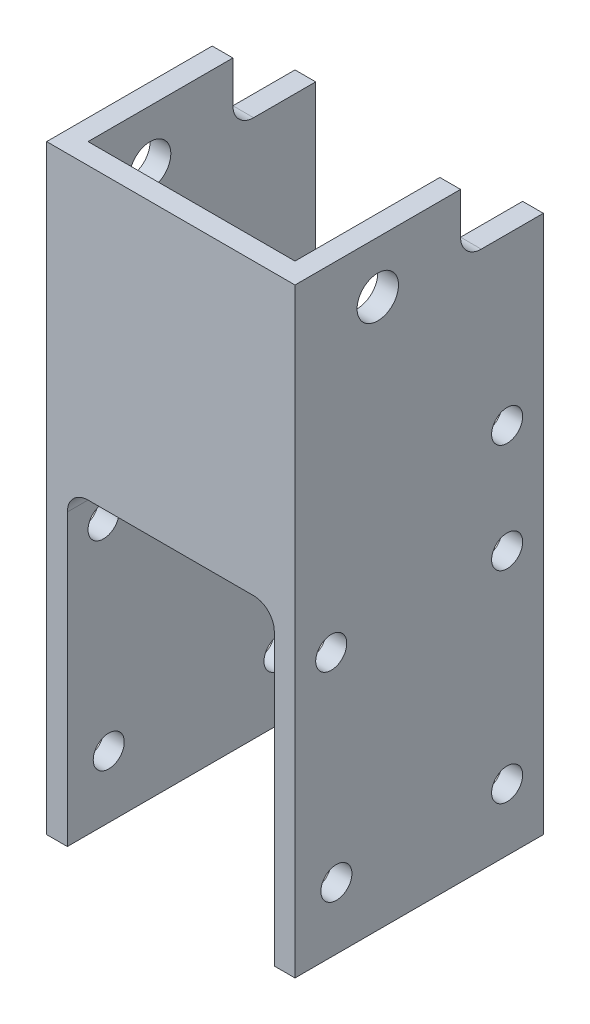
from build123d import *

# Parameters (mm, degrees)
BOSS_EXTRUDE1_DEPTH                 = 184.15
SKETCH2_W                           = 63.5
SKETCH2_H                           = 95.25
CUT_EXTRUDE1_DEPTH                  = 201.603726286
F_3_8_0_375_CLEARANCE_DOWEL_HOLE1_D = 9.525
SKETCH6_W                           = 25.4
SKETCH6_H                           = 19.05
CUT_EXTRUDE2_DEPTH                  = 214.363779728
F_1_2_0_5_DIAMETER_HOLE1_D          = 12.7
FILLET1_R                           = 6.35
F_3_8_0_375_CLAMP_ADJUST_HOLE_D     = 9.525
F_3_8_0_375_CLAMP_ADJUST_HOLE_DEPTH = 82.55
F_3_8_0_375_CLAMP_ADJUST_HOLE_TIP   = 2.861598698


with BuildPart() as part:
    # Sketch1 → Boss-Extrude1 (new body)
    with BuildSketch(Plane(origin=(0, 0, 0), x_dir=(1, 0, 0), z_dir=(0, 1, 0))):
        Polygon((-38.1, 76.2), (-38.1, 0), (0, 0), (38.1, 0), (38.1, 76.2), (31.75, 76.2), (31.75, 6.35), (-31.75, 6.35), (-31.75, 76.2), align=None)
    extrude(amount=BOSS_EXTRUDE1_DEPTH)

    # Sketch2 → Cut-Extrude1 (cut, through all)
    with BuildSketch(Plane(origin=(0, 0, -6.35), x_dir=(-1, 0, 0), z_dir=(0, 0, -1))):
        with Locations((0, 47.625)):
            Rectangle(SKETCH2_W, SKETCH2_H)
    extrude(amount=-CUT_EXTRUDE1_DEPTH, mode=Mode.SUBTRACT)

    # 3/8 (0.375) Clearance Dowel Hole1 (through all)
    with Locations(Plane(origin=(38.1, 0, 0), x_dir=(0, 0, -1), z_dir=(1, 0, 0))):
        with Locations((65.0875, 19.05), (12.7, 19.05), (65.0875, 114.3)):
            Hole(F_3_8_0_375_CLEARANCE_DOWEL_HOLE1_D / 2)

    # Sketch6 → Cut-Extrude2 (cut, through all)
    with BuildSketch(Plane(origin=(38.1, 0, 0), x_dir=(0, 0, -1), z_dir=(1, 0, 0))):
        with Locations((63.5, 174.625)):
            Rectangle(SKETCH6_W, SKETCH6_H)
    extrude(amount=-CUT_EXTRUDE2_DEPTH, mode=Mode.SUBTRACT)

    # 1/2 (0.5) Diameter Hole1 (through all)
    with Locations(Plane(origin=(38.1, 0, 0), x_dir=(0, 0, -1), z_dir=(1, 0, 0))):
        with Locations((25.4, 168.275)):
            Hole(F_1_2_0_5_DIAMETER_HOLE1_D / 2)

    # Fillet1
    fillet1_edges = [part.edges().sort_by_distance(p)[0] for p in [
        (-31.75, 95.25, -3.175),
        (31.75, 95.25, -3.175),
        (34.925, 165.1, -50.8),
        (-34.925, 165.1, -50.8),
    ]]
    fillet(fillet1_edges, radius=FILLET1_R)

    # 3/8 (0.375) Clamp Adjust Hole
    with Locations(Plane(origin=(38.1, 0, 0), x_dir=(0, 0, -1), z_dir=(1, 0, 0))):
        with Locations((11.1125, 80.9752), (65.0875, 80.9752)):
            Hole(F_3_8_0_375_CLAMP_ADJUST_HOLE_D / 2, depth=F_3_8_0_375_CLAMP_ADJUST_HOLE_DEPTH)
            with Locations((0, 0, -(F_3_8_0_375_CLAMP_ADJUST_HOLE_DEPTH + F_3_8_0_375_CLAMP_ADJUST_HOLE_TIP / 2))):  # 118° drill point
                Cone(0, F_3_8_0_375_CLAMP_ADJUST_HOLE_D / 2, F_3_8_0_375_CLAMP_ADJUST_HOLE_TIP, mode=Mode.SUBTRACT)


solid = part.part
